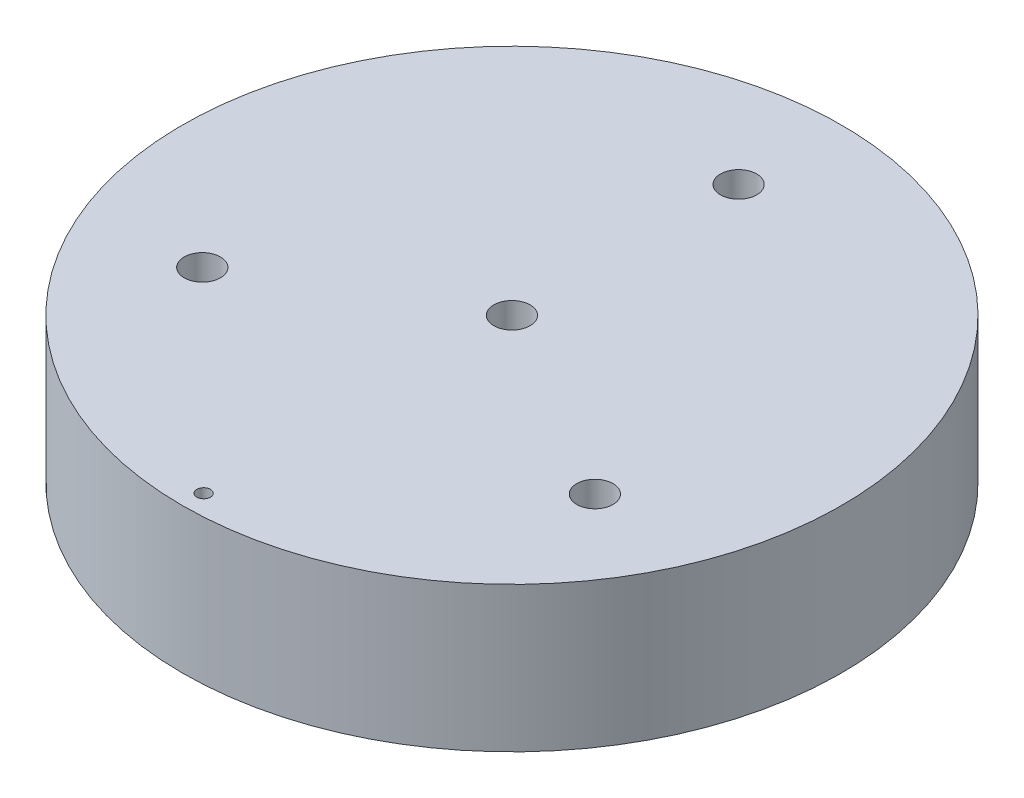
from build123d import *

# Parameters (mm, degrees)
SKETCH1_R           = 72.7
BOSS_EXTRUDE1_DEPTH = 32
SKETCH2_R           = 4
CUT_EXTRUDE1_DEPTH  = 108.678131485
CIRPATTERN1_COUNT   = 3
SKETCH3_R           = 1.5
CUT_EXTRUDE2_DEPTH  = 108.678131485
SKETCH4_R           = 4
CUT_EXTRUDE3_DEPTH  = 108.678131485


with BuildPart() as part:
    # Sketch1 → Boss-Extrude1 (new body)
    with BuildSketch(Plane(origin=(0, 0, 0), x_dir=(1, 0, 0), z_dir=(0, 1, 0))):
        Circle(SKETCH1_R)
    extrude(amount=BOSS_EXTRUDE1_DEPTH)

    # Sketch2 → Cut-Extrude1 (cut, through all)
    with BuildSketch(Plane(origin=(0, 32, 0), x_dir=(1, 0, 0), z_dir=(0, 1, 0))):
        with Locations((0, 50)):
            Circle(SKETCH2_R)
    cut_extrude1 = extrude(amount=-CUT_EXTRUDE1_DEPTH, mode=Mode.SUBTRACT)

    # CirPattern1: Cut-Extrude1 ×3 about axis
    cirpattern1_axis = Axis((0, 33.6, 0), (0, -1, 0))
    for i in range(1, CIRPATTERN1_COUNT):
        add(cut_extrude1.rotate(cirpattern1_axis, i * 360 / CIRPATTERN1_COUNT), mode=Mode.SUBTRACT)

    # Sketch3 → Cut-Extrude2 (cut, through all)
    with BuildSketch(Plane(origin=(0, 32, 0), x_dir=(1, 0, 0), z_dir=(0, 1, 0))):
        with Locations((0, -68)):
            Circle(SKETCH3_R)
    extrude(amount=-CUT_EXTRUDE2_DEPTH, mode=Mode.SUBTRACT)

    # Sketch4 → Cut-Extrude3 (cut, through all)
    with BuildSketch(Plane(origin=(0, 32, 0), x_dir=(1, 0, 0), z_dir=(0, 1, 0))):
        Circle(SKETCH4_R)
    extrude(amount=-CUT_EXTRUDE3_DEPTH, mode=Mode.SUBTRACT)


solid = part.part
